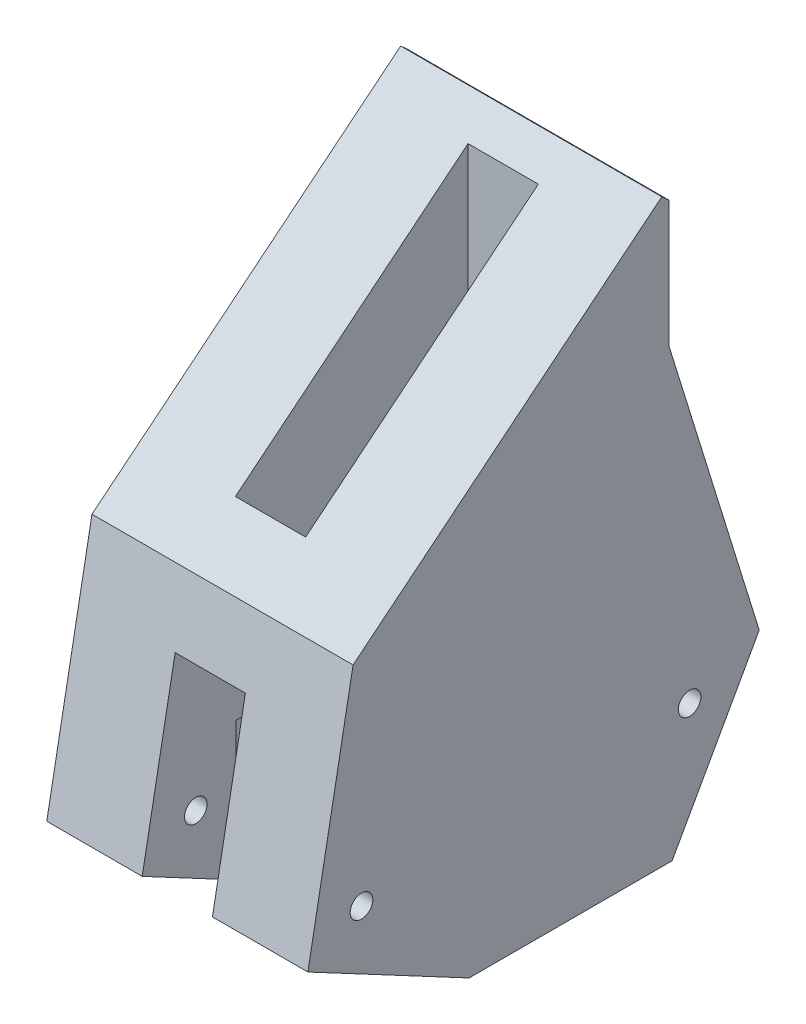
from build123d import *

# Parameters (mm, degrees)
EXTRUDE_1_DEPTH          = 22.5
SKETCH_2_W               = 40.1
SKETCH_2_H               = 134.948718637
CUT_EXTRUDE_1_DEPTH      = 6.05
SKETCH_3_W               = 40
SKETCH_3_H               = 54.532079191
CUT_EXTRUDE_2_DEPTH      = 17
CUT_EXTRUDE_3_DEPTH      = 115.04494728
CUT_EXTRUDE_3_DEPTH_BACK = 115.04494728
SKETCH_4_R               = 1.95
SKETCH_5_W               = 28.894932664
SKETCH_5_H               = 60.313820621
SKETCH_5_W_2             = 36.035634414
SKETCH_5_H_2             = 53.811811248
CUT_EXTRUDE_4_DEPTH      = 6.05


with BuildPart() as part:
    # 스케치1 → 보스-돌출1 (new, symmetric)
    with BuildSketch(Plane(origin=(0, 0, 0), x_dir=(0, 0, -1), z_dir=(1, 0, 0))):
        Polygon((0, 0), (34.990619137, 0), (50, 26.923076923), (34.47567302, 76.995358537), (34.47567302, 98.842339146), (33.205617909, 100), (-19.995898679, 56.72140075), (-27.785311637, 14.783172795), align=None)
    extrude(amount=EXTRUDE_1_DEPTH, both=True)

    # 스케치2 → 컷-돌출1 (cut, symmetric)
    with BuildSketch(Plane(origin=(0, 0, 0), x_dir=(0, 0, -1), z_dir=(1, 0, 0))):
        with Locations((8.32658036, 49.272905611)):
            Rectangle(SKETCH_2_W, SKETCH_2_H)
    extrude(amount=CUT_EXTRUDE_1_DEPTH, both=True, mode=Mode.SUBTRACT)

    # 스케치3 → 컷-돌출2 (cut, symmetric)
    with BuildSketch(Plane(origin=(0, 0, 0), x_dir=(0, 0, -1), z_dir=(1, 0, 0))):
        with Locations((8.37658036, 2.733960405)):
            Rectangle(SKETCH_3_W, SKETCH_3_H)
    extrude(amount=CUT_EXTRUDE_2_DEPTH, both=True, mode=Mode.SUBTRACT)

    # 스케치4 → 컷-돌출3 (cut, two sides: drawn at the far end of the back side and taken through both)
    with BuildSketch(Plane(origin=(0, 0, 0), x_dir=(0, 0, -1), z_dir=(1, 0, 0)).offset(-CUT_EXTRUDE_3_DEPTH_BACK)):
        with Locations((-18.546360236, 20)):
            Circle(SKETCH_4_R)
        with Locations((38, 22)):
            Circle(SKETCH_4_R)
    extrude(amount=CUT_EXTRUDE_3_DEPTH + CUT_EXTRUDE_3_DEPTH_BACK, mode=Mode.SUBTRACT)

    # 스케치5 → 컷-돌출4 (cut, symmetric)
    with BuildSketch(Plane(origin=(0, 0, 0), x_dir=(0, 0, -1), z_dir=(1, 0, 0))):
        with Locations((-22.490735836, 15.187792046)):
            Rectangle(SKETCH_5_W, SKETCH_5_H)
        with Locations((41.692548501, 13.265290011)):
            Rectangle(SKETCH_5_W_2, SKETCH_5_H_2)
    extrude(amount=CUT_EXTRUDE_4_DEPTH, both=True, mode=Mode.SUBTRACT)


solid = part.part
